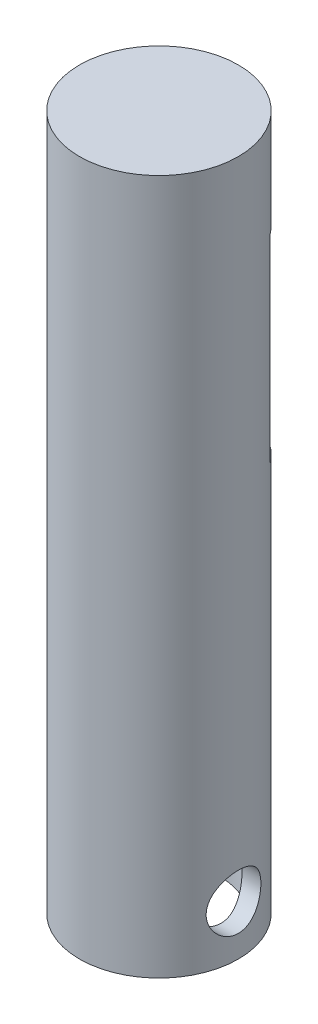
from build123d import *
from build123d.topology import SkipClean

# Parameters (mm, degrees)
BOSS_EXTRUDE1_DEPTH = 44.45
BOSS_EXTRUDE2_DEPTH = 25.4
BOSS_EXTRUDE3_START = -6.35
BOSS_EXTRUDE3_DEPTH = 6.35
SKETCH5_R           = 3.96875
CUT_EXTRUDE1_DEPTH  = 6.35
SKETCH6_R           = 1.75
CUT_EXTRUDE2_DEPTH  = 46.878475345


with BuildPart() as part:
    # Sketch1 → Boss-Extrude1 (new body)
    with BuildSketch(Plane(origin=(0, 0, 0), x_dir=(1, 0, 0), z_dir=(0, 1, 0))):
        with BuildLine():
            Line((-4.099560952, 3), (4.099560952, 3))
            ThreePointArc((4.099560952, 3), (0, -5.08), (-4.099560952, 3))
        make_face()
    extrude(amount=BOSS_EXTRUDE1_DEPTH)

    # Sketch3 → Boss-Extrude2 (add)
    with SkipClean():  # the faces are left unmerged after this step: merging them gives an invalid solid
        with BuildSketch(Plane.XZ):
            with BuildLine():
                Line((-4.099560952, -3), (4.099560952, -3))
                ThreePointArc((4.099560952, -3), (0, -5.08), (-4.099560952, -3))
            make_face()
        extrude(amount=-BOSS_EXTRUDE2_DEPTH)

    # Sketch4 → Boss-Extrude3 (add)
    with SkipClean():  # the faces are left unmerged after this step: merging them gives an invalid solid
        with BuildSketch(Plane(origin=(0, 44.45, 0), x_dir=(1, 0, 0), z_dir=(0, 1, 0)).offset(BOSS_EXTRUDE3_START)):
            with BuildLine():
                Line((-4.099560952, 3), (4.099560952, 3))
                ThreePointArc((4.099560952, 3), (0, 5.08), (-4.099560952, 3))
            make_face()
        extrude(amount=BOSS_EXTRUDE3_DEPTH)

    # Sketch5 → Cut-Extrude1 (cut)
    with SkipClean():  # the faces are left unmerged after this step: merging them gives an invalid solid
        with BuildSketch(Plane.XZ):
            with Locations(Location((0, 0, 0), (0, 0, 270))):
                Circle(SKETCH5_R)
        extrude(amount=-CUT_EXTRUDE1_DEPTH, mode=Mode.SUBTRACT)

    # Sketch6 → Cut-Extrude2 (cut, through all)
    with BuildSketch(Plane(origin=(5.08, 0, 0), x_dir=(0, 0, -1), z_dir=(1, 0, 0))):
        with Locations((0, 3.175)):
            Circle(SKETCH6_R)
    extrude(amount=-CUT_EXTRUDE2_DEPTH, mode=Mode.SUBTRACT)


solid = part.part
